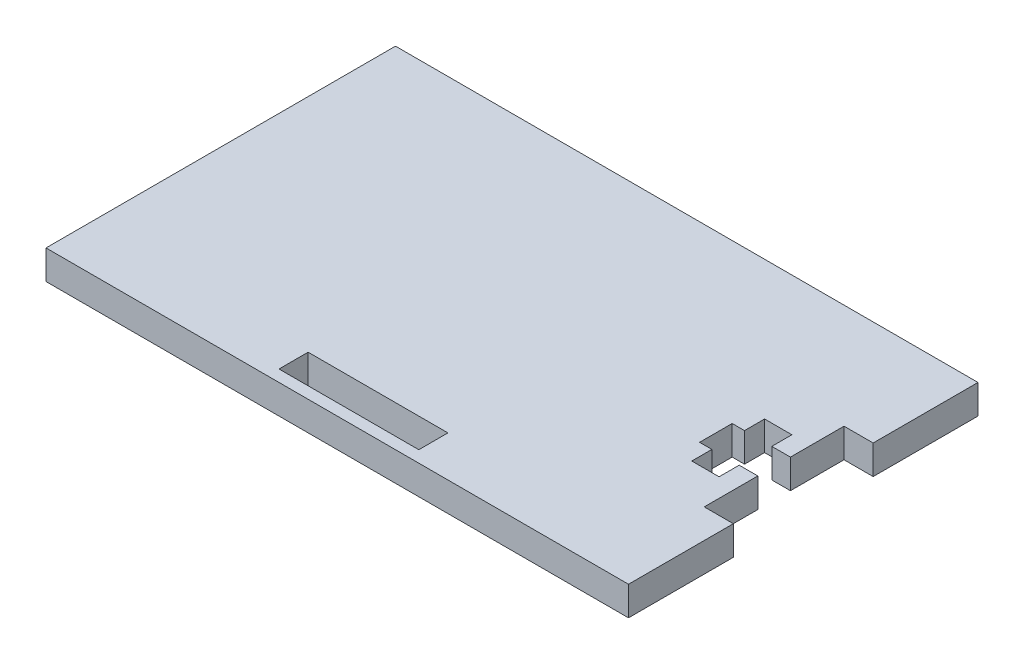
from build123d import *

# Parameters (mm, degrees)
SKETCH1_W           = 15.24
SKETCH1_H           = 3.175
BOSS_EXTRUDE1_DEPTH = 3.175


with BuildPart() as part:
    # Sketch1 → Boss-Extrude1 (new body)
    with BuildSketch(Plane(origin=(0, 0, 0), x_dir=(1, 0, 0), z_dir=(0, 1, 0))):
        Polygon((0, 0), (63.5, 0), (63.5, 11.43), (60.325, 11.43), (60.325, 17.272), (58.293, 17.272), (58.293, 15.08125), (55.3164375, 15.08125), (55.3164375, 17.272), (53.975, 17.272), (53.975, 20.828), (55.3164375, 20.828), (55.3164375, 23.01875), (58.293, 23.01875), (58.293, 20.828), (60.325, 20.828), (60.325, 26.67), (63.5, 26.67), (63.5, 38.1), (0, 38.1), align=None)
        with Locations((31.75, 2.8575)):
            Rectangle(SKETCH1_W, SKETCH1_H, mode=Mode.SUBTRACT)
    extrude(amount=BOSS_EXTRUDE1_DEPTH)


solid = part.part
